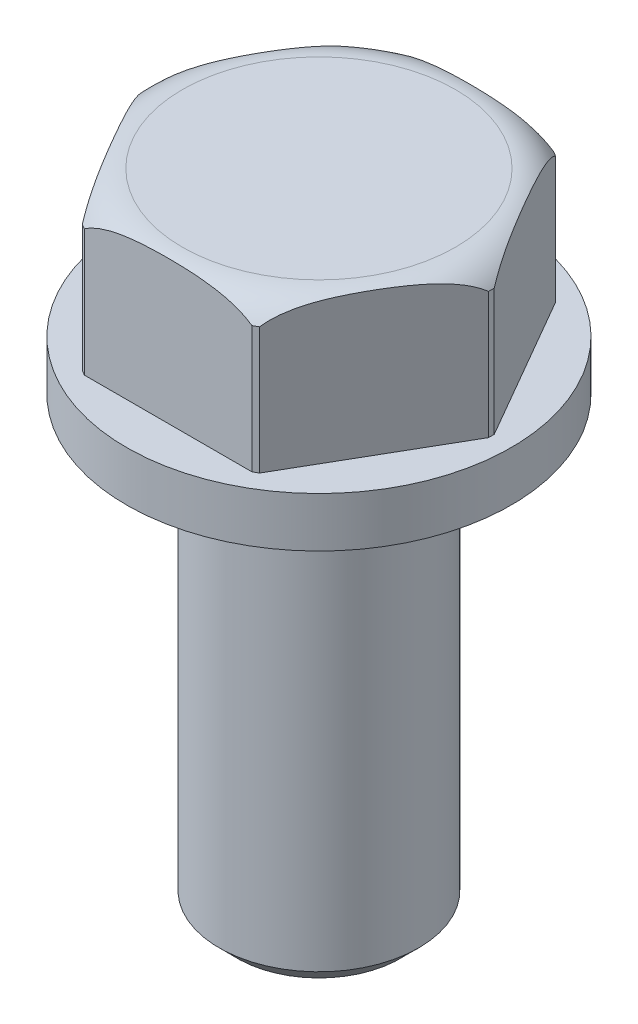
from build123d import *

# Parameters (mm, degrees)
SKETCH3_W          = 10.668
SKETCH3_H          = 5.397434481
CUT_EXTRUDE1_DEPTH = 9.271
CIRPATTERN1_COUNT  = 6
CHAMFER1_SIZE      = 1.16332


with BuildPart() as part:
    # Sketch1 → Revolve1 (revolve)
    with BuildSketch(Plane.XY, mode=Mode.PRIVATE) as revolve1_sk:
        Polygon((0, 0), (6.35, 0), (6.35, 28.5496), (12.2555, 28.5496), (12.2555, 31.7246), (10.9855, 31.7246), (10.9855, 40.9956), (0, 40.9956), align=None)
    revolve(revolve1_sk.sketch.rotate(Axis((0, 40.9956, 0), (0, -1, 0)), 180), axis=Axis((0, 40.9956, 0), (0, -1, 0)))

    # Sketch3 → Cut-Extrude1 (cut)
    with BuildSketch(Plane(origin=(0, 40.9956, 0), x_dir=(1, 0, 0), z_dir=(0, 1, 0))):
        with Locations((0, 12.302344381)):
            Rectangle(SKETCH3_W, SKETCH3_H)
    cut_extrude1 = extrude(amount=-CUT_EXTRUDE1_DEPTH, mode=Mode.SUBTRACT)

    # CirPattern1: Cut-Extrude1 ×6 about axis
    cirpattern1_axis = Axis((0, 0, 0), (0, 1, 0))
    for i in range(1, CIRPATTERN1_COUNT):
        add(cut_extrude1.rotate(cirpattern1_axis, i * 360 / CIRPATTERN1_COUNT), mode=Mode.SUBTRACT)

    # Sketch4 → Cut-Revolve1 (revolve, cut)
    with BuildSketch(Plane.XY):
        with BuildLine():
            Line((11.176, 39.4716), (11.176, 40.9956))
            Line((11.176, 40.9956), (8.6995, 40.9956))
            ThreePointArc((8.6995, 40.9956), (10.153428149, 40.584076992), (11.176, 39.4716))
        make_face()
    revolve(axis=Axis((0, 28.5496, 0), (0, 1, 0)), mode=Mode.SUBTRACT)

    # Chamfer1
    chamfer1_edges = [part.edges().sort_by_distance(p)[0] for p in [
        (6.35, 0, 0),
    ]]
    chamfer(chamfer1_edges, length=CHAMFER1_SIZE)


solid = part.part
